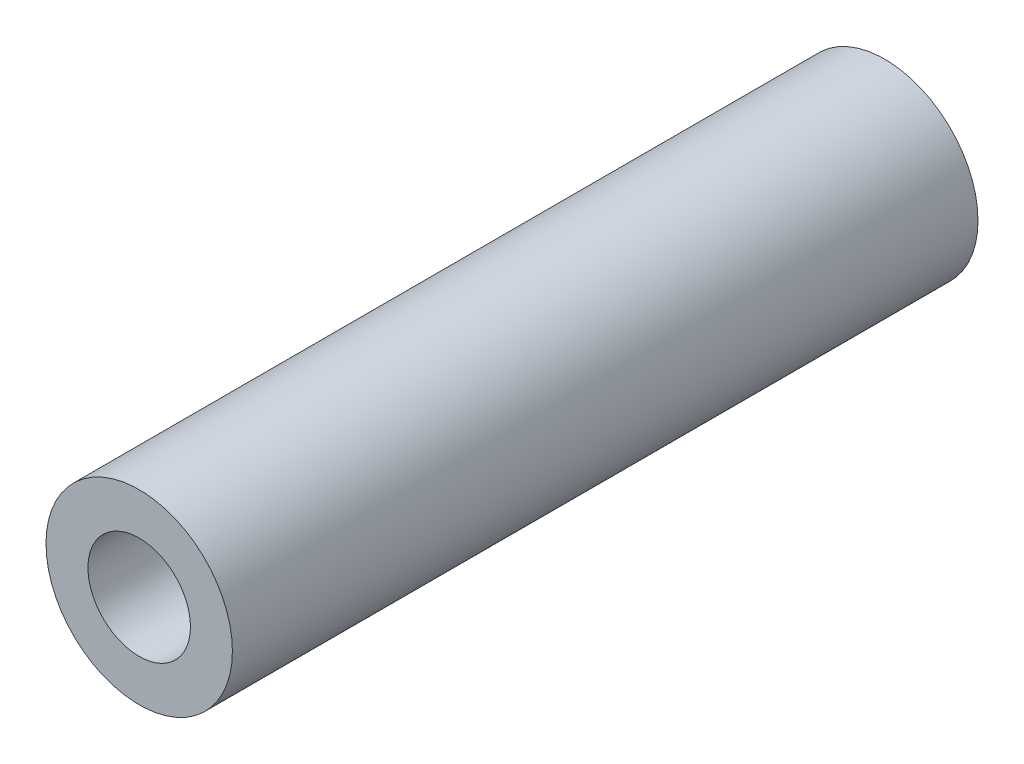
from build123d import *

# Parameters (mm, degrees)
SKETCH1_R           = 3
SKETCH1_R_2         = 1.65
BOSS_EXTRUDE1_DEPTH = 12


with BuildPart() as part:
    # Sketch1 → Boss-Extrude1 (new, symmetric)
    with BuildSketch(Plane.XY):
        Circle(SKETCH1_R)
        Circle(SKETCH1_R_2, mode=Mode.SUBTRACT)
    extrude(amount=BOSS_EXTRUDE1_DEPTH, both=True)


solid = part.part
